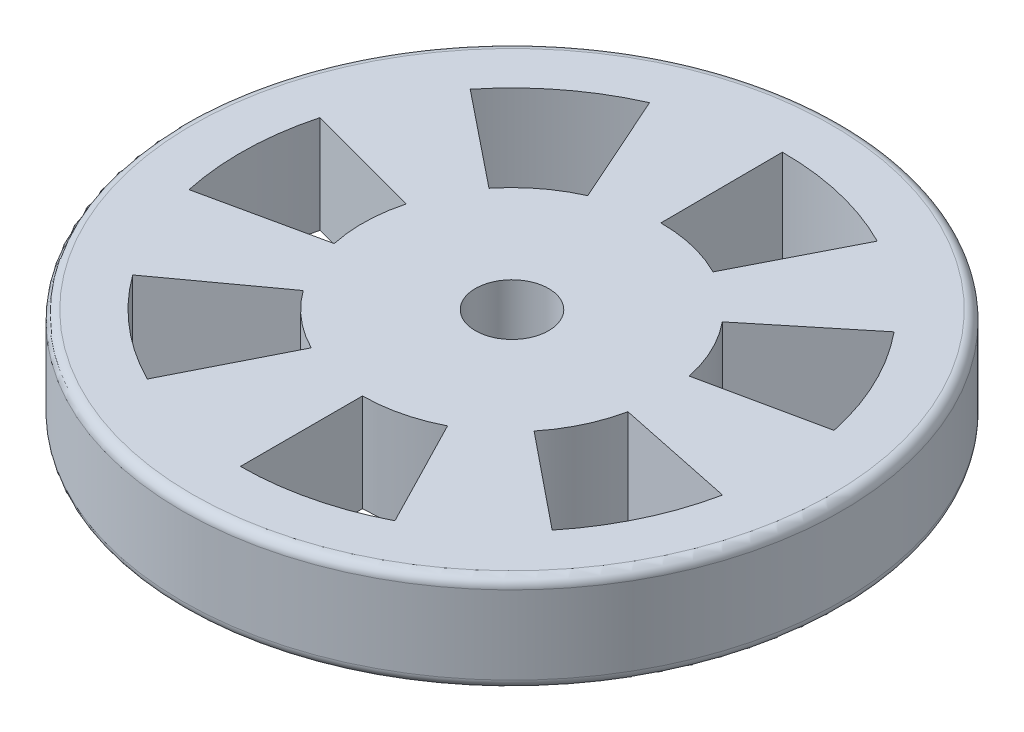
from build123d import *

# Parameters (mm, degrees)
SKETCH1_R           = 67.5
BOSS_EXTRUDE1_DEPTH = 20
FILLET1_R           = 2
SKETCH2_R           = 7.5
CUT_EXTRUDE1_DEPTH  = 98.532046085
CUT_EXTRUDE2_DEPTH  = 98.532046085
CIRPATTERN1_COUNT   = 7
CIRPATTERN1_ANGLE   = 306


with BuildPart() as part:
    # Sketch1 → Boss-Extrude1 (new body)
    with BuildSketch(Plane(origin=(0, 0, 0), x_dir=(1, 0, 0), z_dir=(0, 1, 0))):
        with Locations(Location((0, 0, 0), (0, 0, 270))):
            Circle(SKETCH1_R)
    extrude(amount=BOSS_EXTRUDE1_DEPTH)

    # Fillet1
    fillet1_edges = [part.edges().sort_by_distance(p)[0] for p in [
        (0, 0, -67.5),
        (0, 20, -67.5),
    ]]
    fillet(fillet1_edges, radius=FILLET1_R)

    # Sketch2 → Cut-Extrude1 (cut, through all)
    with BuildSketch(Plane(origin=(0, 20, 0), x_dir=(1, 0, 0), z_dir=(0, 1, 0))):
        with Locations(Location((0, 0, 0), (0, 0, 270))):
            Circle(SKETCH2_R)
    extrude(amount=-CUT_EXTRUDE1_DEPTH, mode=Mode.SUBTRACT)

    # Sketch3 → Cut-Extrude2 (cut, through all)
    with BuildSketch(Plane.XZ):
        with BuildLine():
            Line((0, 30.617728898), (0, 55.617728898))
            ThreePointArc((0, 55.617728898), (13.100293951, 54.052882126), (25.463414591, 49.446398101))
            Line((25.463414591, 49.446398101), (14.017687169, 27.220392527))
            ThreePointArc((14.017687169, 27.220392527), (7.21175166, 29.756275991), (0, 30.617728898))
        make_face()
    cut_extrude2 = extrude(amount=-CUT_EXTRUDE2_DEPTH, mode=Mode.SUBTRACT)

    # CirPattern1: Cut-Extrude2 ×7 about axis
    cirpattern1_axis = Axis((0, 0, 0), (0, 1, 0))
    for i in range(1, CIRPATTERN1_COUNT):
        add(cut_extrude2.rotate(cirpattern1_axis, i * CIRPATTERN1_ANGLE / (CIRPATTERN1_COUNT - 1)), mode=Mode.SUBTRACT)


solid = part.part
